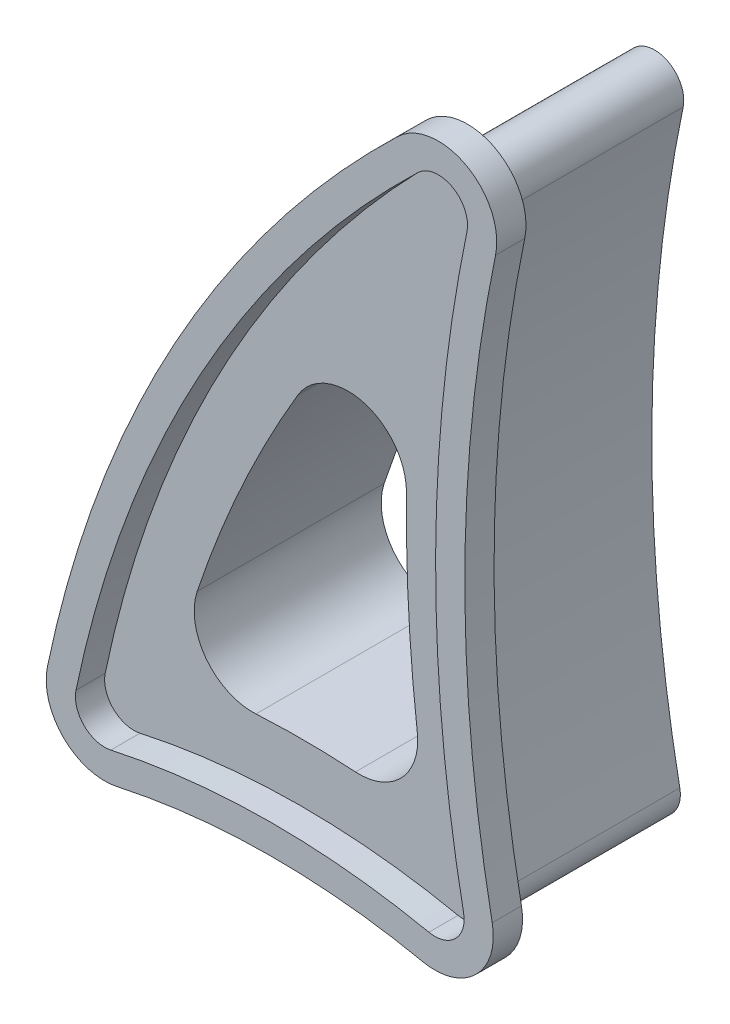
from build123d import *

# Parameters (mm, degrees)
EXTRUDE_1_DEPTH = 6.4
EXTRUDE_2_DEPTH = 1


with BuildPart() as part:
    # 草图1 → 凸台-拉伸1 (new body)
    with BuildSketch(Plane.XY):
        with BuildLine():
            ThreePointArc((-1.607555315, 23.253403092), (-2.102834102, 24.33260587), (-3.280118278, 24.177745667))
            ThreePointArc((-3.280118278, 24.177745667), (-10.73316918, 14.464202841), (-14.985773436, 2.983077502))
            ThreePointArc((-14.985773436, 2.983077502), (-14.710247084, 2.069013261), (-13.793473674, 1.802639986))
            ThreePointArc((-13.793473674, 1.802639986), (-8.353711957, 2.400269849), (-2.909355589, 1.846056223))
            ThreePointArc((-2.909355589, 1.846056223), (-2.001398399, 2.113095791), (-1.722710728, 3.017545663))
            ThreePointArc((-1.722710728, 3.017545663), (-2.678876467, 13.141243248), (-1.607555315, 23.253403092))
        make_face()
        with BuildLine():
            ThreePointArc((-11.838265008, 6.985769863), (-10.31805168, 10.845138893), (-8.396540596, 14.521220098))
            ThreePointArc((-8.396540596, 14.521220098), (-6.135950273, 15.427541437), (-4.675992097, 13.478128935))
            ThreePointArc((-4.675992097, 13.478128935), (-4.604024648, 10.019753035), (-4.3066146, 6.573437547))
            ThreePointArc((-4.3066146, 6.573437547), (-4.841051661, 4.960613716), (-6.423033433, 4.340809432))
            ThreePointArc((-6.423033433, 4.340809432), (-8.12545588, 4.400199712), (-9.828339295, 4.355956396))
            ThreePointArc((-9.828339295, 4.355956396), (-11.530116514, 5.138298702), (-11.838265008, 6.985769863))
        make_face(mode=Mode.SUBTRACT)
    extrude(amount=-EXTRUDE_1_DEPTH)


with BuildPart() as body_2:
    # 草图1<8> → 凸台-拉伸2 (new body)
    with BuildSketch(Plane.XY):
        with BuildLine():
            ThreePointArc((-15.964862672, 3.186508738), (-15.413809968, 1.358380256), (-13.580263148, 0.825633706))
            ThreePointArc((-13.580263148, 0.825633706), (-8.349723035, 1.400277805), (-3.11476499, 0.867380088))
            ThreePointArc((-3.11476499, 0.867380088), (-1.29885061, 1.401459224), (-0.741475267, 3.210358968))
            ThreePointArc((-0.741475267, 3.210358968), (-1.678892658, 13.135552679), (-0.628577803, 23.049434879))
            ThreePointArc((-0.628577803, 23.049434879), (-1.619135377, 25.207840435), (-3.97370373, 24.898120029))
            ThreePointArc((-3.97370373, 24.898120029), (-11.608536362, 14.947661524), (-15.964862672, 3.186508738))
        make_face()
        with BuildLine():
            ThreePointArc((-14.985773436, 2.983077502), (-10.73316918, 14.464202841), (-3.280118278, 24.177745667))
            ThreePointArc((-3.280118278, 24.177745667), (-2.102834102, 24.33260587), (-1.607555315, 23.253403092))
            ThreePointArc((-1.607555315, 23.253403092), (-2.678876467, 13.141243248), (-1.722710728, 3.017545663))
            ThreePointArc((-1.722710728, 3.017545663), (-2.001398399, 2.113095791), (-2.909355589, 1.846056223))
            ThreePointArc((-2.909355589, 1.846056223), (-8.353711957, 2.400269849), (-13.793473674, 1.802639986))
            ThreePointArc((-13.793473674, 1.802639986), (-14.710247084, 2.069013261), (-14.985773436, 2.983077502))
        make_face(mode=Mode.SUBTRACT)
    extrude(amount=EXTRUDE_2_DEPTH)


solid = Compound([part.part, body_2.part])
